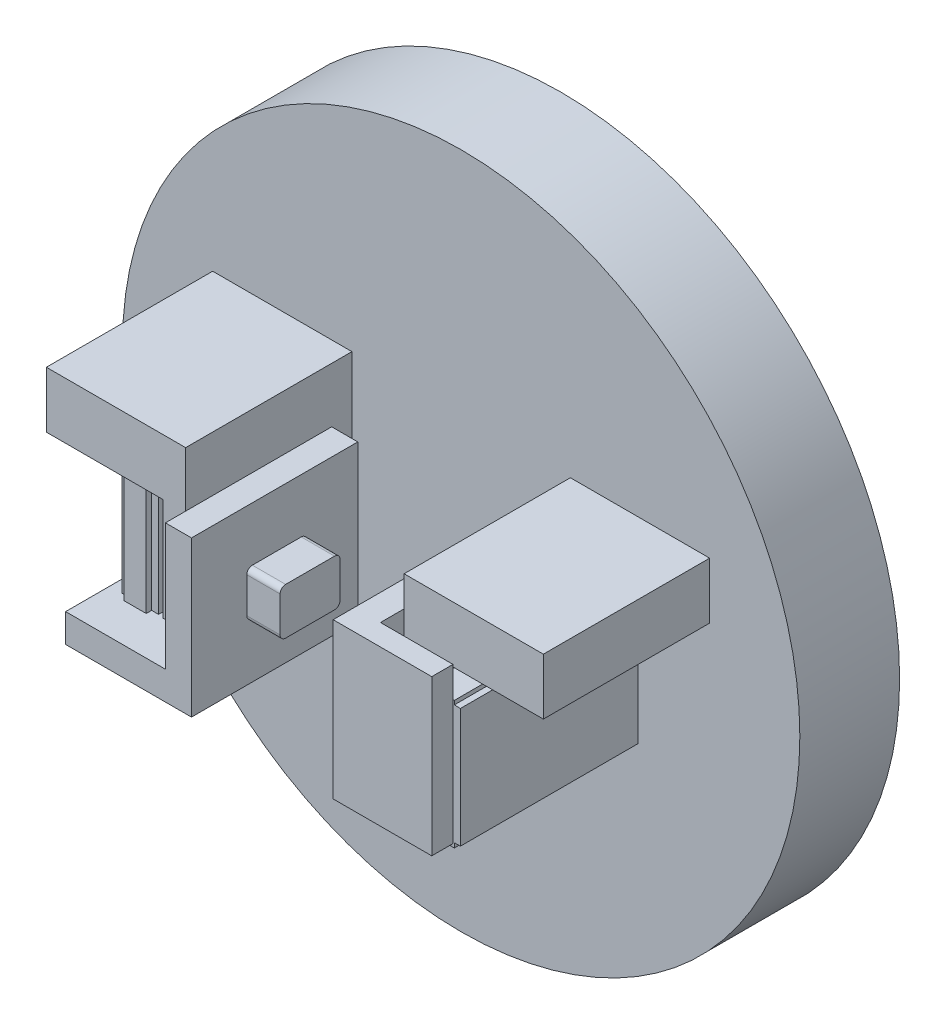
from build123d import *

# Parameters (mm, degrees)
SKETCH_1_R             = 30.549115646
EXTRUDE_1_DEPTH        = 9
EXTRUDE_2_DEPTH        = 15
SKETCH_8_W             = 2.353970865
SKETCH_8_H             = 15
EXTRUDE_3_DEPTH        = 8
EXTRUDE_3_2_DEPTH      = 8
SKETCH_12_W            = 2.353970865
SKETCH_12_H            = 15
EXTRUDE_5_DEPTH        = 6
EXTRUDE_START          = -8.741924
SKETCH_14_W            = 15
SKETCH_14_H            = 2.566345669
EXTRUDE_7_DEPTH        = 9
SKETCH_15_W            = 6.541100851
SKETCH_15_H            = 1.915380037
EXTRUDE_8_DEPTH        = 6
SKETCH_15_2_W          = 6.541100851
SKETCH_15_2_H          = 1.915380037
EXTRUDE_9_DEPTH        = 8
EXTRUDE_10_DEPTH       = 16.020510359
EXTRUDE_11_DEPTH       = 12.778725016
SKETCH_19_W            = 5.407207082
SKETCH_19_H            = 4.197700235
EXTRUDE_12_DEPTH       = 3
FILLET_1_R             = 0.5
FILLET_1_OF_MIRROR_4_R = 0.5


with BuildPart() as part:
    # 草图1 → 凸台-拉伸1 (new body)
    with BuildSketch(Plane.XY):
        Circle(SKETCH_1_R)
    extrude(amount=EXTRUDE_1_DEPTH)

    # 草图3 → 凸台-拉伸2 (add)
    with BuildSketch(Plane.XY.offset(9)):
        Polygon((-22.413460509, 4.778725016), (-11.904585252, 4.778725016), (-11.904585252, -4.489323984), (-9.852070554, -4.489323984), (-9.852070554, 7.306952327), (-9.852070554, 9.852070554), (-22.413460509, 9.852070554), align=None)
        Polygon((22.413460509, 9.852070554), (9.852070554, 9.852070554), (9.852070554, 7.306952327), (9.852070554, -4.489323984), (11.904585252, -4.489323984), (11.904585252, 4.778725016), (22.413460509, 4.778725016), align=None)
    extrude(amount=EXTRUDE_2_DEPTH)



with BuildPart() as body_2:
    # 草图8 → 凸台-拉伸3 (new body)
    with BuildSketch(Plane(origin=(0, 0, 0), x_dir=(1, 0, 0), z_dir=(0, 1, 0))):
        with Locations((-7.564938163, -19.435890396)):
            Rectangle(SKETCH_8_W, SKETCH_8_H)
    extrude(amount=-EXTRUDE_3_DEPTH)



with BuildPart() as body_3:
    # 草图8 → Extrude 3 2 (new body)
    with BuildSketch(Plane(origin=(0, 0, 0), x_dir=(1, 0, 0), z_dir=(0, 1, 0))):
        with Locations((7.564938163, -19.435890396)):
            Rectangle(SKETCH_8_W, SKETCH_8_H)
    extrude(amount=-EXTRUDE_3_2_DEPTH)


with BuildPart() as body_2_1:
    add(body_2.part)

    add(body_3.part)  # 凸台-拉伸5 merges body 3
    # 草图12 → 凸台-拉伸5 (add)
    with BuildSketch(Plane(origin=(0, 0, 0), x_dir=(1, 0, 0), z_dir=(0, 1, 0))):
        with Locations((-7.564938163, -19.435890396)):
            Rectangle(SKETCH_12_W, SKETCH_12_H)
        with Locations((7.564938163, -19.435890396)):
            Rectangle(SKETCH_12_W, SKETCH_12_H)
    extrude(amount=EXTRUDE_5_DEPTH)


with BuildPart() as extrude_7_tool:
    # 草图14 → 凸台-拉伸7 (new body)
    with BuildSketch(Plane(origin=(0, 0, 0), x_dir=(0, 0, -1), z_dir=(1, 0, 0)).offset(EXTRUDE_START)):
        with Locations((-19.435890396, -6.716827165)):
            Rectangle(SKETCH_14_W, SKETCH_14_H)
    extrude(amount=-EXTRUDE_7_DEPTH)


with BuildPart() as body_2_2:
    add(body_2_1.part)


with BuildPart() as body_2_3:
    # 凸台-拉伸7: joined with extrude_7_tool
    add(body_2_2.part.fuse(extrude_7_tool.part, tol=0.00001))

    # 草图15 → 凸台-拉伸8 (add)
    with BuildSketch(Plane(origin=(0, 0, 0), x_dir=(1, 0, 0), z_dir=(0, 1, 0))):
        with Locations((12.012474021, -25.978200378)):
            Rectangle(SKETCH_15_W, SKETCH_15_H)
    extrude(amount=EXTRUDE_8_DEPTH)

    # 草图15<2> → 凸台-拉伸9 (add)
    with BuildSketch(Plane(origin=(0, 0, 0), x_dir=(1, 0, 0), z_dir=(0, 1, 0))):
        with Locations((12.012474021, -25.978200378)):
            Rectangle(SKETCH_15_2_W, SKETCH_15_2_H)
    extrude(amount=-EXTRUDE_9_DEPTH)


with BuildPart() as part_1:
    add(part.part)

    add(body_2_3.part)  # 凸台-拉伸10 merges body 2
    # 草图16 → 凸台-拉伸10 (add)
    with BuildSketch(Plane.XY.offset(9)):
        Polygon((15.402096143, -7.866023052), (15.954530634, -7.866023052), (15.954530634, 2.891816022), (15.402096143, 2.891816022), (15.402096143, 3.244620079), (12.852605538, 3.244620079), (12.852605538, 2.891816022), (12.56859722, 2.891816022), (12.56859722, -7.866023052), (12.852605538, -7.866023052), (12.852605538, -8.286124494), (15.402096143, -8.286124494), align=None)
    extrude(amount=EXTRUDE_10_DEPTH)

    # 草图18 → 凸台-拉伸11 (add)
    with BuildSketch(Plane.XZ.offset(-4.778725016)):
        Polygon((-15.980879444, 13.400073381), (-16.608948942, 13.400073381), (-16.608948942, 22.960686847), (-15.980879444, 22.960686847), (-15.980879444, 23.449185345), (-13.957099951, 23.449185345), (-13.957099951, 22.960686847), (-13.329030453, 22.960686847), (-13.329030453, 13.400073381), (-13.957099951, 13.400073381), (-13.957099951, 13.108195893), (-15.980879444, 13.108195893), align=None)
    extrude(amount=EXTRUDE_11_DEPTH)

    # 草图19 → 凸台-拉伸12 (add)
    with BuildSketch(Plane(origin=(-6.38795273, 0, 0), x_dir=(0, 0, -1), z_dir=(1, 0, 0))):
        with Locations((-19.241101822, -0.973659034)):
            Rectangle(SKETCH_19_W, SKETCH_19_H)
    extrude_12 = extrude(amount=EXTRUDE_12_DEPTH)

    # 圆角1
    fillet_1_edges = [part_1.edges().sort_by_distance(p)[0] for p in [
        (-4.88795273, 1.125191084, 21.944705363),
        (-4.88795273, -3.072509151, 21.944705363),
        (-4.88795273, -3.072509151, 16.537498281),
        (-4.88795273, 1.125191084, 16.537498281),
    ]]
    fillet(fillet_1_edges, radius=FILLET_1_R)

    # 镜向4: 凸台-拉伸12 across plane
    add(extrude_12.mirror(Plane(origin=(0, 0, 0), x_dir=(0, 0, 1), z_dir=(1, 0, 0))))

    # 圆角1 of 镜向4
    fillet_1_of_mirror_4_edges = [part_1.edges().sort_by_distance(p)[0] for p in [
        (4.88795273, 1.125191084, 21.944705363),
        (4.88795273, -3.072509151, 21.944705363),
        (4.88795273, -3.072509151, 16.537498281),
        (4.88795273, 1.125191084, 16.537498281),
    ]]
    fillet(fillet_1_of_mirror_4_edges, radius=FILLET_1_OF_MIRROR_4_R)


solid = part_1.part
